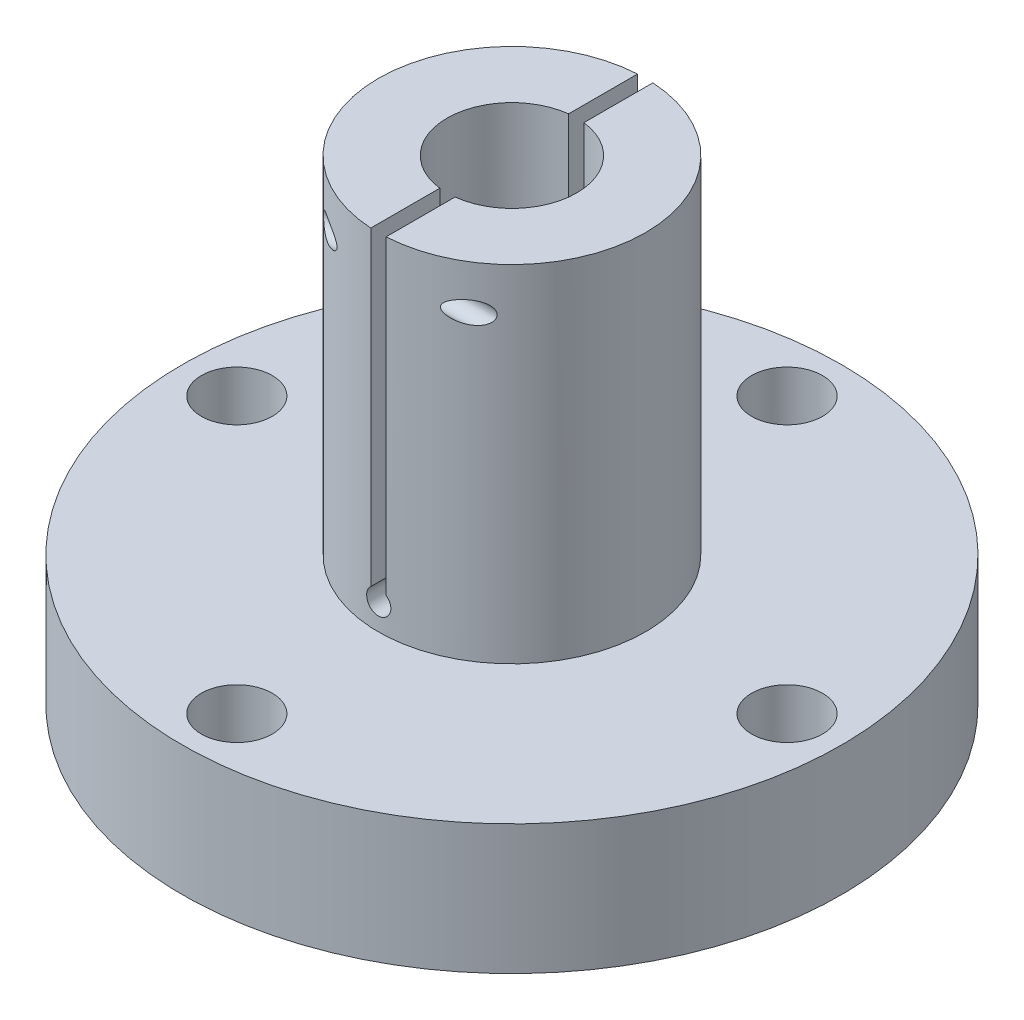
from build123d import *

# Parameters (mm, degrees)
CUT_EXTRUDE1_DEPTH = 20
SKETCH3_R          = 1.25
CUT_EXTRUDE2_DEPTH = 17
SKETCH4_R          = 0.502757778
SKETCH4_R_2        = 0.50259211
CUT_EXTRUDE3_DEPTH = 3
SKETCH5_R          = 2.25
CUT_EXTRUDE4_DEPTH = 6
SKETCH6_R          = 4.1
CUT_EXTRUDE5_DEPTH = 26


with BuildPart() as part:
    # Sketch1 → Revolve1 (revolve)
    with BuildSketch(Plane.XY, mode=Mode.PRIVATE) as revolve1_sk:
        Polygon((7.5, 61.86812787), (15.454011649, 61.86812787), (15.454011649, 21.86812787), (38.123522242, 21.86812787), (38.123522242, 6.86812787), (25, 6.86812787), (25, 13.86812787), (9, 13.86812787), (9, 21.86812787), (7.5, 21.86812787), align=None)
    revolve(revolve1_sk.sketch.rotate(Axis((0, 0, 0), (0, 1, 0)), 90), axis=Axis((0, 0, 0), (0, 1, 0)))

    # Sketch2 → Cut-Extrude1 (cut, symmetric)
    with BuildSketch(Plane.XY):
        with BuildLine():
            Line((-0.897403203, 116.981683018), (0.871590836, 116.981683018))
            Line((0.871590836, 116.981683018), (0.871590836, 25.953330627))
            ThreePointArc((0.871590836, 25.953330627), (-0.012906183, 23.46812787), (-0.897403203, 25.953330627))
            Line((-0.897403203, 25.953330627), (-0.897403203, 116.981683018))
        make_face()
    extrude(amount=CUT_EXTRUDE1_DEPTH, both=True, mode=Mode.SUBTRACT)

    # Sketch3 → Cut-Extrude2 (cut)
    with BuildSketch(Plane(origin=(20, 0, 0), x_dir=(0, 0, -1), z_dir=(1, 0, 0))):
        with Locations((-13, 56.805856976)):
            Circle(SKETCH3_R)
        with Locations((13, 56.805856976)):
            Circle(SKETCH3_R)
    cut_extrude2 = extrude(amount=-CUT_EXTRUDE2_DEPTH, mode=Mode.SUBTRACT)

    # Sketch4 → Cut-Extrude3 (cut)
    with BuildSketch(Plane(origin=(3, 0, 0), x_dir=(0, 0, -1), z_dir=(1, 0, 0))):
        with Locations((13, 56.805856976)):
            Circle(SKETCH4_R)
        with Locations((-13, 56.805856976)):
            Circle(SKETCH4_R_2)
    cut_extrude3 = extrude(amount=-CUT_EXTRUDE3_DEPTH, mode=Mode.SUBTRACT)

    # Mirror1: Cut-Extrude2, Cut-Extrude3 across plane
    add(cut_extrude2.mirror(Plane(origin=(0, 0, 0), x_dir=(0, 0, 1), z_dir=(1, 0, 0))), mode=Mode.SUBTRACT)
    add(cut_extrude3.mirror(Plane(origin=(0, 0, 0), x_dir=(0, 0, 1), z_dir=(1, 0, 0))), mode=Mode.SUBTRACT)

    # Sketch5 → Cut-Extrude4 (cut)
    with BuildSketch(Plane.XZ.offset(-6.86812787)):
        with Locations(Location((31.825233869, 0, 0), (0, 0, 270))):
            Circle(SKETCH5_R)
        with Locations(Location((0, -31.825233869, 0), (0, 0, 270))):
            Circle(SKETCH5_R)
        with Locations(Location((-31.825233869, 0, 0), (0, 0, 270))):
            Circle(SKETCH5_R)
        with Locations(Location((0, 31.825233869, 0), (0, 0, 270))):
            Circle(SKETCH5_R)
    extrude(amount=-CUT_EXTRUDE4_DEPTH, mode=Mode.SUBTRACT)

    # Sketch6 → Cut-Extrude5 (cut)
    with BuildSketch(Plane.XZ.offset(-12.86812787)):
        with Locations(Location((0, 31.825233869, 0), (0, 0, 270))):
            Circle(SKETCH6_R)
        with Locations(Location((31.825233869, 0, 0), (0, 0, 270))):
            Circle(SKETCH6_R)
        with Locations(Location((0, -31.825233869, 0), (0, 0, 270))):
            Circle(SKETCH6_R)
        with Locations(Location((-31.825233869, 0, 0), (0, 0, 270))):
            Circle(SKETCH6_R)
    extrude(amount=-CUT_EXTRUDE5_DEPTH, mode=Mode.SUBTRACT)


solid = part.part
